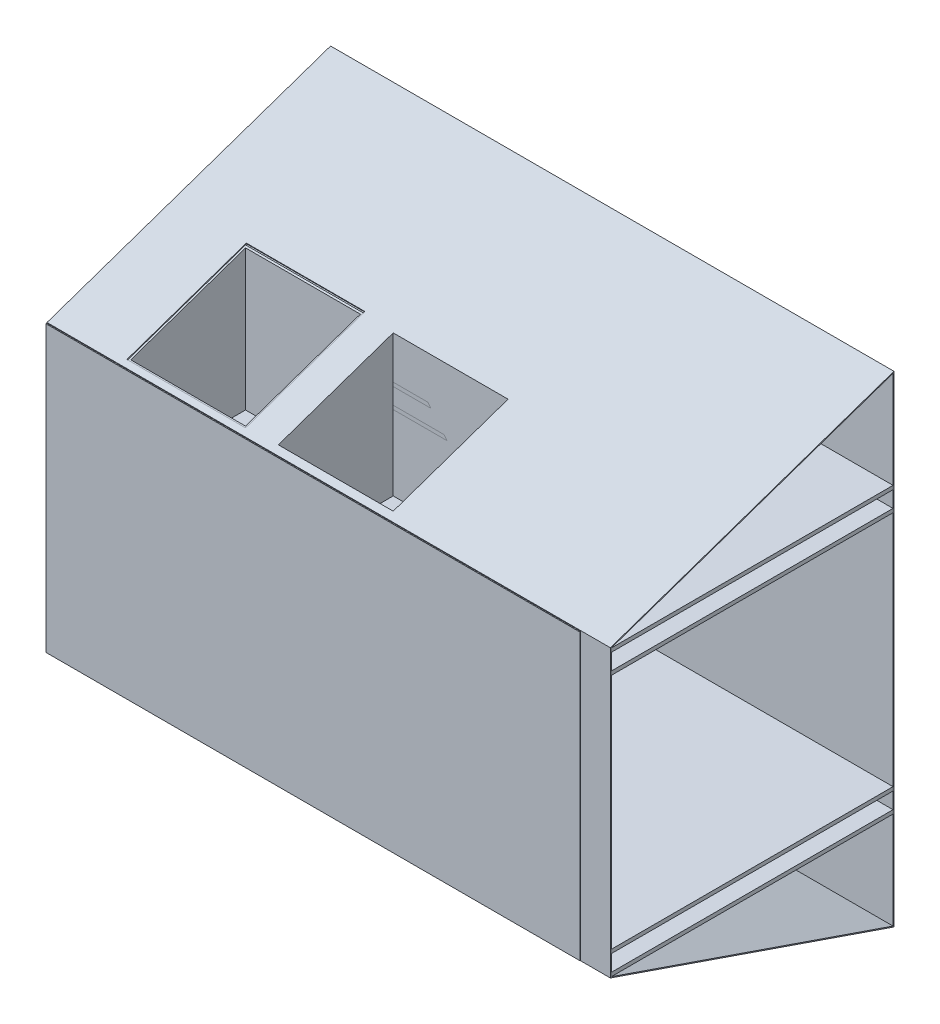
from build123d import *

# Parameters (mm, degrees)
SKETCH1_W                       = 1800
SKETCH1_H                       = 960
BOSS_EXTRUDE1_DEPTH             = 6.35
BOSS_EXTRUDE2_DEPTH             = 1900
SKETCH6_W                       = 400
SKETCH6_H                       = 425.788292868
CUT_EXTRUDE1_DEPTH              = 300
SKETCH7_W                       = 400
SKETCH7_H                       = 425.67110899
CUT_EXTRUDE2_DEPTH              = 300
BOSS_EXTRUDE4_REACH             = 2489.303
SKETCH8_W                       = 400
SKETCH8_H                       = 400
SKETCH8_W_2                     = 387.3
SKETCH8_H_2                     = 387.3
BOSS_EXTRUDE4_DIRECTION_2_REACH = 2489.303
SKETCH11_R                      = 131.35
BOSS_EXTRUDE6_DEPTH             = 30
SKETCH12_R                      = 125
CUT_EXTRUDE5_DEPTH              = 20
BOSS_EXTRUDE7_REACH             = 2489.303
SKETCH14_W                      = 400
SKETCH14_H                      = 400
SKETCH14_W_2                    = 387.3
SKETCH14_H_2                    = 387.3
BOSS_EXTRUDE7_DIRECTION_2_REACH = 2489.303
CUT_EXTRUDE6_START              = -1104.02001
SKETCH15_W                      = 387.3
SKETCH15_H                      = 387.3
CUT_EXTRUDE6_DEPTH              = 1248.04002
SKETCH16_W                      = 400
SKETCH16_H                      = 200
CUT_EXTRUDE8_DEPTH              = 940
SKETCH18_W                      = 4.075824643
SKETCH18_H                      = 122.071298875
CUT_EXTRUDE9_DEPTH              = 410
SKETCH19_W                      = 387.3
SKETCH19_H                      = 387.3
BOSS_EXTRUDE22_DEPTH            = 10
SKETCH22_W                      = 387.3
SKETCH22_H                      = 389.400481364
BOSS_EXTRUDE24_DEPTH            = 10
SKETCH23_W                      = 387.3
SKETCH23_H                      = 387.3
BOSS_EXTRUDE25_DEPTH            = 10
SKETCH24_W                      = 387.3
SKETCH24_H                      = 387.3
BOSS_EXTRUDE26_DEPTH            = 10
SKETCH25_W                      = 950
SKETCH25_H                      = 12.7
BOSS_EXTRUDE27_DEPTH            = 1900
SKETCH26_W                      = 387.3
SKETCH26_H                      = 387.3
CUT_EXTRUDE10_DEPTH             = 300
SKETCH27_W                      = 387.3
SKETCH27_H                      = 387.3
CUT_EXTRUDE11_DEPTH             = 300
SKETCH28_W                      = 387.3
SKETCH28_H                      = 387.3
CUT_EXTRUDE12_DEPTH             = 300
SKETCH29_W                      = 387.3
SKETCH29_H                      = 387.3
CUT_EXTRUDE13_DEPTH             = 300


with BuildPart() as part:
    # Sketch1 → Boss-Extrude1 (new body)
    with BuildSketch(Plane.XY):
        with Locations((900, -480)):
            Rectangle(SKETCH1_W, SKETCH1_H)
    extrude(amount=BOSS_EXTRUDE1_DEPTH)

    # Sketch2 → Boss-Extrude2 (add)
    with BuildSketch(Plane(origin=(0, 0, 0), x_dir=(0, 0, -1), z_dir=(1, 0, 0))):
        Polygon((-3.175, -962.264705491), (-3.175, 2.264705491), (953.175, 331.56241846), (953.175, -1291.56241846), align=None)
        Polygon((0, 0), (950, 327.111232625), (950, -1287.111232625), (0, -960), align=None, mode=Mode.SUBTRACT)
    extrude(amount=BOSS_EXTRUDE2_DEPTH)

    # Sketch6 → Cut-Extrude1 (cut)
    with BuildSketch(Plane(origin=(0, 3.002021478, 1.03367889), x_dir=(1, 0, 0), z_dir=(0, 0.9455185755993153, 0.32556815445716086))):
        with Locations((449.631164922, 231.795224093)):
            Rectangle(SKETCH6_W, SKETCH6_H)
    extrude(amount=-CUT_EXTRUDE1_DEPTH, mode=Mode.SUBTRACT)

    # Sketch7 → Cut-Extrude2 (cut)
    with BuildSketch(Plane(origin=(0, -861.247183209, 296.551187047), x_dir=(1, 0, 0), z_dir=(0, -0.9455185755993154, 0.32556815445716053))):
        with Locations((449.631164922, -584.134563657)):
            Rectangle(SKETCH7_W, SKETCH7_H)
    extrude(amount=-CUT_EXTRUDE2_DEPTH, mode=Mode.SUBTRACT)

    # Sketch11 → Boss-Extrude6 (add)
    with BuildSketch(Plane(origin=(0, 0, -953.175), x_dir=(-1, 0, 0), z_dir=(0, 0, -1))):
        with Locations(Location((-350, -492.20758154, 0), (0, 0, 90))):
            Circle(SKETCH11_R)
    extrude(amount=-BOSS_EXTRUDE6_DEPTH)

    # Sketch12 → Cut-Extrude5 (cut)
    with BuildSketch(Plane(origin=(0, 0, -953.175), x_dir=(-1, 0, 0), z_dir=(0, 0, -1))):
        with Locations(Location((-350, -492.20758154, 0), (0, 0, 90))):
            Circle(SKETCH12_R)
    extrude(amount=-CUT_EXTRUDE5_DEPTH, mode=Mode.SUBTRACT)

    # Boss-Extrude7: up to this plane
    boss_extrude7_end = Plane(origin=(1900, 0, 0), z_dir=(0, -0.9455185755993153, -0.325568154457161))
    # Sketch14 → Boss-Extrude7 (add, up to the surface)
    with BuildSketch(Plane(origin=(0, 0, 0), x_dir=(1, 0, 0), z_dir=(0, 1, 0)), mode=Mode.PRIVATE) as boss_extrude7_sk1:
        with Locations((949.631164922, 212.761816492)):
            Rectangle(SKETCH14_W, SKETCH14_H)
        with Locations((949.631164922, 212.761816492)):
            Rectangle(SKETCH14_W_2, SKETCH14_H_2, mode=Mode.SUBTRACT)
    boss_extrude7_tool1 = split(extrude(boss_extrude7_sk1.sketch, amount=BOSS_EXTRUDE7_REACH, mode=Mode.PRIVATE), bisect_by=boss_extrude7_end, keep=Keep.BOTH, mode=Mode.PRIVATE)
    add(boss_extrude7_tool1.solids().sort_by_distance((949.631165, 0, -407.104962))[0])

    # Boss-Extrude7 direction 2: up to this plane
    boss_extrude7_direction_2_end = Plane(origin=(1900, -1287.111232625, -950), z_dir=(0, 0.9455185755993156, -0.3255681544571603))
    # Sketch14 → Boss-Extrude7 direction 2 (add, up to the surface)
    with BuildSketch(Plane(origin=(0, 0, 0), x_dir=(1, 0, 0), z_dir=(0, 1, 0)), mode=Mode.PRIVATE) as boss_extrude7_direction_2_sk1:
        with Locations((949.631164922, 212.761816492)):
            Rectangle(SKETCH14_W, SKETCH14_H)
        with Locations((949.631164922, 212.761816492)):
            Rectangle(SKETCH14_W_2, SKETCH14_H_2, mode=Mode.SUBTRACT)
    boss_extrude7_direction_2_tool1 = split(extrude(boss_extrude7_direction_2_sk1.sketch, amount=-BOSS_EXTRUDE7_DIRECTION_2_REACH, mode=Mode.PRIVATE), bisect_by=boss_extrude7_direction_2_end, keep=Keep.BOTH, mode=Mode.PRIVATE)
    add(boss_extrude7_direction_2_tool1.solids().sort_by_distance((949.631165, 0, -407.104962))[0])

    # Sketch15 → Cut-Extrude6 (cut)
    with BuildSketch(Plane(origin=(0, 0, 0), x_dir=(1, 0, 0), z_dir=(0, 1, 0)).offset(CUT_EXTRUDE6_START)):
        with Locations((949.631164922, 214.862297856)):
            Rectangle(SKETCH15_W, SKETCH15_H)
    extrude(amount=CUT_EXTRUDE6_DEPTH, mode=Mode.SUBTRACT)


with BuildPart() as body_2:
    # Boss-Extrude4: up to this plane
    boss_extrude4_end = Plane(origin=(1900, -1287.111232625, -950), z_dir=(0, 0.9455185755993156, -0.3255681544571603))
    # Sketch8 → Boss-Extrude4 (new, up to the surface)
    with BuildSketch(Plane(origin=(0, 0, 0), x_dir=(1, 0, 0), z_dir=(0, 1, 0)), mode=Mode.PRIVATE) as boss_extrude4_sk1:
        with Locations((449.631164922, 216.837641135)):
            Rectangle(SKETCH8_W, SKETCH8_H)
        with Locations((449.631164922, 216.837641135)):
            Rectangle(SKETCH8_W_2, SKETCH8_H_2, mode=Mode.SUBTRACT)
    boss_extrude4_tool1 = split(extrude(boss_extrude4_sk1.sketch, amount=-BOSS_EXTRUDE4_REACH, mode=Mode.PRIVATE), bisect_by=boss_extrude4_end, keep=Keep.BOTH, mode=Mode.PRIVATE)
    add(boss_extrude4_tool1.solids().sort_by_distance((449.631165, 0, -22.494495))[0])

    # Boss-Extrude4 direction 2: up to this plane
    boss_extrude4_direction_2_end = Plane(origin=(1900, 0, 0), z_dir=(0, -0.9455185755993153, -0.325568154457161))
    # Sketch8 → Boss-Extrude4 direction 2 (add, up to the surface)
    with BuildSketch(Plane(origin=(0, 0, 0), x_dir=(1, 0, 0), z_dir=(0, 1, 0)), mode=Mode.PRIVATE) as boss_extrude4_direction_2_sk1:
        with Locations((449.631164922, 216.837641135)):
            Rectangle(SKETCH8_W, SKETCH8_H)
        with Locations((449.631164922, 216.837641135)):
            Rectangle(SKETCH8_W_2, SKETCH8_H_2, mode=Mode.SUBTRACT)
    boss_extrude4_direction_2_tool1 = split(extrude(boss_extrude4_direction_2_sk1.sketch, amount=BOSS_EXTRUDE4_DIRECTION_2_REACH, mode=Mode.PRIVATE), bisect_by=boss_extrude4_direction_2_end, keep=Keep.BOTH, mode=Mode.PRIVATE)
    add(boss_extrude4_direction_2_tool1.solids().sort_by_distance((449.631165, 0, -22.494495))[0])


with BuildPart() as cut_extrude8_tool:
    # Sketch16 → Cut-Extrude8 (new body)
    with BuildSketch(Plane.ZY.offset(-249.631164922)):
        with Locations((-216.837641135, -432.198710101)):
            Rectangle(SKETCH16_W, SKETCH16_H)
    extrude(amount=-CUT_EXTRUDE8_DEPTH)


with BuildPart() as part_1:
    add(part.part)

    # Cut-Extrude8: cut by cut_extrude8_tool
    add(cut_extrude8_tool.part, mode=Mode.SUBTRACT)

    # Sketch18 → Cut-Extrude9 (cut)
    with BuildSketch(Plane(origin=(1149.631164922, 0, 0), x_dir=(0, 0, -1), z_dir=(1, 0, 0))):
        with Locations((14.799728814, -471.163060664)):
            Rectangle(SKETCH18_W, SKETCH18_H)
    extrude(amount=-CUT_EXTRUDE9_DEPTH, mode=Mode.SUBTRACT)


with BuildPart() as body_2_1:
    add(body_2.part)

    # Cut-Extrude8: cut by cut_extrude8_tool
    add(cut_extrude8_tool.part, mode=Mode.SUBTRACT)

    # Sketch25 → Boss-Extrude27 (add)
    with BuildSketch(Plane(origin=(0, 0, 0), x_dir=(0, 0, -1), z_dir=(1, 0, 0))):
        with Locations((475, -953.65)):
            Rectangle(SKETCH25_W, SKETCH25_H)
        with Locations((475, -886.35)):
            Rectangle(SKETCH25_W, SKETCH25_H)
        with Locations((475, -73.65)):
            Rectangle(SKETCH25_W, SKETCH25_H)
        with Locations((475, -6.35)):
            Rectangle(SKETCH25_W, SKETCH25_H)
    extrude(amount=BOSS_EXTRUDE27_DEPTH)

    # Sketch26 → Cut-Extrude10 (cut)
    with BuildSketch(Plane(origin=(0, 0, 0), x_dir=(1, 0, 0), z_dir=(0, 1, 0))):
        with Locations((449.631164922, 216.837641135)):
            Rectangle(SKETCH26_W, SKETCH26_H)
    extrude(amount=-CUT_EXTRUDE10_DEPTH, mode=Mode.SUBTRACT)

    # Sketch27 → Cut-Extrude11 (cut)
    with BuildSketch(Plane(origin=(0, 0, 0), x_dir=(1, 0, 0), z_dir=(0, 1, 0))):
        with Locations((949.631164922, 214.862297856)):
            Rectangle(SKETCH27_W, SKETCH27_H)
    extrude(amount=-CUT_EXTRUDE11_DEPTH, mode=Mode.SUBTRACT)

    # Sketch28 → Cut-Extrude12 (cut)
    with BuildSketch(Plane.XZ.offset(960)):
        with Locations((949.631164922, -214.862297856)):
            Rectangle(SKETCH28_W, SKETCH28_H)
    extrude(amount=-CUT_EXTRUDE12_DEPTH, mode=Mode.SUBTRACT)

    # Sketch29 → Cut-Extrude13 (cut)
    with BuildSketch(Plane.XZ.offset(960)):
        with Locations((449.631164922, -216.837641135)):
            Rectangle(SKETCH29_W, SKETCH29_H)
    extrude(amount=-CUT_EXTRUDE13_DEPTH, mode=Mode.SUBTRACT)


with BuildPart() as body_3:
    # Sketch19 → Boss-Extrude22 (new body)
    with BuildSketch(Plane.XZ.offset(332.198710101)):
        with Locations((949.631164922, -214.862297856)):
            Rectangle(SKETCH19_W, SKETCH19_H)
    extrude(amount=BOSS_EXTRUDE22_DEPTH)


with BuildPart() as body_4:
    # Sketch22 → Boss-Extrude24 (new body)
    with BuildSketch(Plane(origin=(0, -532.198710101, 0), x_dir=(1, 0, 0), z_dir=(0, 1, 0))):
        with Locations((949.631164922, 213.812057174)):
            Rectangle(SKETCH22_W, SKETCH22_H)
    extrude(amount=BOSS_EXTRUDE24_DEPTH)


with BuildPart() as body_5:
    # Sketch23 → Boss-Extrude25 (new body)
    with BuildSketch(Plane(origin=(0, -532.198710101, 0), x_dir=(1, 0, 0), z_dir=(0, 1, 0))):
        with Locations((449.631164922, 216.837641135)):
            Rectangle(SKETCH23_W, SKETCH23_H)
    extrude(amount=BOSS_EXTRUDE25_DEPTH)


with BuildPart() as body_6:
    # Sketch24 → Boss-Extrude26 (new body)
    with BuildSketch(Plane.XZ.offset(332.198710101)):
        with Locations((449.631164922, -216.837641135)):
            Rectangle(SKETCH24_W, SKETCH24_H)
    extrude(amount=BOSS_EXTRUDE26_DEPTH)


solid = Compound([part_1.part, body_2_1.part, body_3.part, body_4.part, body_5.part, body_6.part])
